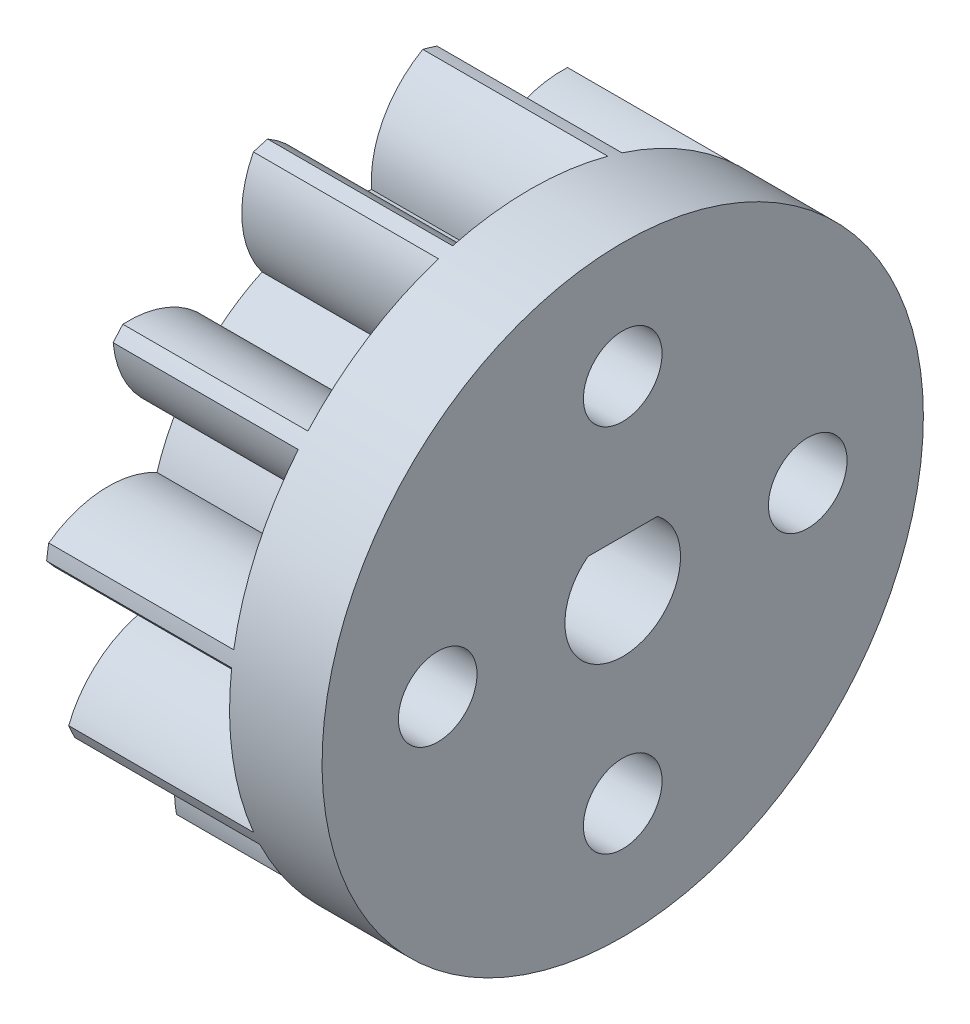
from build123d import *

# Parameters (mm, degrees)
BASPROSKE_W                  = 8
BASPROSKE_H                  = 13
TOOTHCUT_DEPTH               = 21.049937656
TEETHCUTS_COUNT              = 11
TEETHCUTS_ANGLE              = 327.272727273
BORSKE_R                     = 0.4
BORE_DEPTH                   = 50.0000508
ESTRUSIONE_ESTRUSIONE1_START = 4
SCHIZZO2_R                   = 13
ESTRUSIONE_ESTRUSIONE1_DEPTH = 4
TAGLIO_ESTRUSIONE1_DEPTH     = 14
FORO_PER_VITE_M3_1_D         = 3.4
FORO_PER_VITE_M3_1_DEPTH     = 3
FORO_PER_VITE_M3_1_TIP       = 1.021463052


with BuildPart() as part:
    # BasProSke → Base-Revolve (revolve)
    with BuildSketch(Plane(origin=(0, 0, 0), x_dir=(1, 0, 0), z_dir=(0, 1, 0)), mode=Mode.PRIVATE) as base_revolve_sk:
        with Locations((4, 6.5)):
            Rectangle(BASPROSKE_W, BASPROSKE_H)
    revolve(base_revolve_sk.sketch.rotate(Axis((-10, 0, 0), (1, 0, 0)), 180), axis=Axis((-10, 0, 0), (1, 0, 0)))

    # TooCutSke → ToothCut (cut, through all)
    with BuildSketch(Plane(origin=(0, 0, 0), x_dir=(0, 0, -1), z_dir=(1, 0, 0))):
        with BuildLine():
            ThreePointArc((1.139858048, 8.422216135), (0, 8.499), (-1.139858048, 8.422216135))
            ThreePointArc((-1.139858048, 8.422216135), (-1.658602184, 10.826907356), (-3.387115532, 12.577300725))
            ThreePointArc((-3.387115532, 12.577300725), (0, 13.0254), (3.387115532, 12.577300725))
            ThreePointArc((3.387115532, 12.577300725), (1.658602184, 10.826907356), (1.139858048, 8.422216135))
        make_face()
    toothcut = extrude(amount=TOOTHCUT_DEPTH, mode=Mode.SUBTRACT)

    # TeethCuts: ToothCut ×11 about axis
    teethcuts_axis = Axis((-10, 0, 0), (1, 0, 0))
    for i in range(1, TEETHCUTS_COUNT):
        add(toothcut.rotate(teethcuts_axis, i * TEETHCUTS_ANGLE / (TEETHCUTS_COUNT - 1)), mode=Mode.SUBTRACT)

    # BorSke → Bore (cut, symmetric)
    with BuildSketch(Plane(origin=(0, 0, 0), x_dir=(0, 0, -1), z_dir=(1, 0, 0))):
        with Locations(Location((0, 0, 0), (0, 0, 180))):
            Circle(BORSKE_R)
    extrude(amount=BORE_DEPTH, both=True, mode=Mode.SUBTRACT)

    # Schizzo2 → Estrusione-Estrusione1 (add)
    with BuildSketch(Plane(origin=(8, 0, 0), x_dir=(0, 0, -1), z_dir=(1, 0, 0)).offset(ESTRUSIONE_ESTRUSIONE1_START)):
        with Locations(Location((0, 0, 0), (0, 0, 173.223714884))):
            Circle(SCHIZZO2_R)
    extrude(amount=-ESTRUSIONE_ESTRUSIONE1_DEPTH)

    # Schizzo1 → Taglio-Estrusione1 (cut)
    with BuildSketch(Plane(origin=(12, 0, 0), x_dir=(0, 0, -1), z_dir=(1, 0, 0))):
        with BuildLine():
            Line((-1.5, 2), (1.5, 2))
            ThreePointArc((1.5, 2), (0, -2.5), (-1.5, 2))
        make_face()
    extrude(amount=-TAGLIO_ESTRUSIONE1_DEPTH, mode=Mode.SUBTRACT)

    # Foro per Vite M3-1
    with Locations(Plane(origin=(12, 0, 0), x_dir=(0, 0, -1), z_dir=(1, 0, 0))):
        with Locations((0, 8), (8, 0), (0, -8), (-8, 0)):
            Hole(FORO_PER_VITE_M3_1_D / 2, depth=FORO_PER_VITE_M3_1_DEPTH)
            with Locations((0, 0, -(FORO_PER_VITE_M3_1_DEPTH + FORO_PER_VITE_M3_1_TIP / 2))):  # 118° drill point
                Cone(0, FORO_PER_VITE_M3_1_D / 2, FORO_PER_VITE_M3_1_TIP, mode=Mode.SUBTRACT)


solid = part.part
